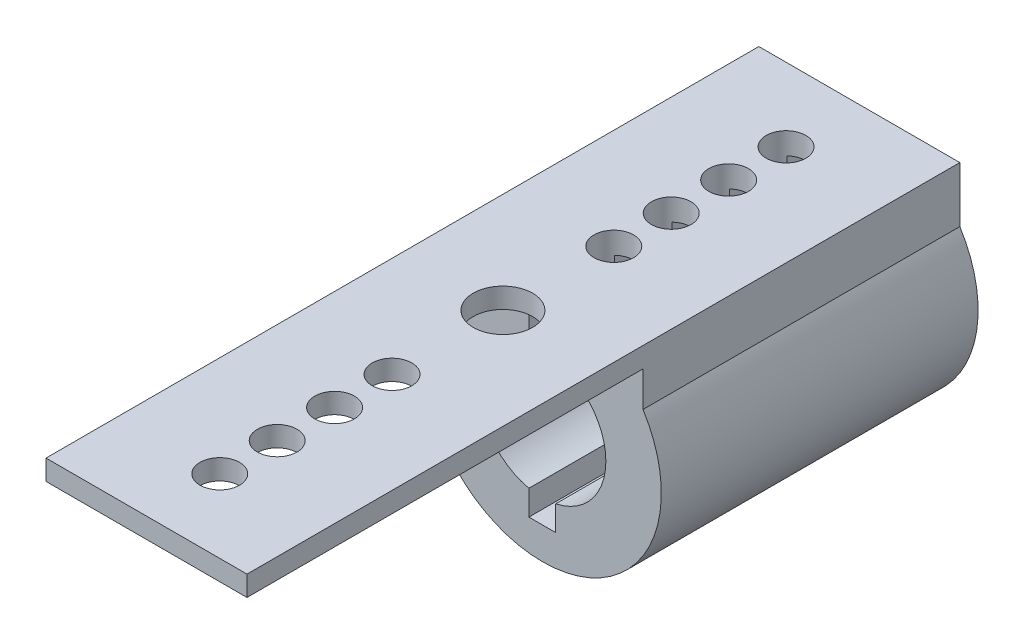
from build123d import *

# Parameters (mm, degrees)
SKETCH1_R               = 6
SKETCH1_R_2             = 3.2
BOSS_EXTRUDE1_DEPTH     = 16
SKETCH2_W               = 10.150862032
SKETCH2_H               = 2.8
BOSS_EXTRUDE2_DEPTH     = 16
CUT_EXTRUDE1_DEPTH      = 16
CUT_EXTRUDE1_DEPTH_BACK = 1
SKETCH3_W               = 1.354750416
SKETCH3_H               = 9.28691227
SKETCH4_W               = 10.150862032
SKETCH4_H               = 1.022764777
BOSS_EXTRUDE3_DEPTH     = 36
SKETCH5_R               = 1.5
CUT_EXTRUDE2_DEPTH      = 11
CUT_EXTRUDE3_DEPTH      = 11
CUT_EXTRUDE3_DEPTH_BACK = 0.1
SKETCH6_R               = 1


with BuildPart() as part:
    # Sketch1 → Boss-Extrude1 (new body)
    with BuildSketch(Plane.XY):
        Circle(SKETCH1_R)
        Circle(SKETCH1_R_2, mode=Mode.SUBTRACT)
    extrude(amount=BOSS_EXTRUDE1_DEPTH)

    # Sketch2 → Boss-Extrude2 (add)
    with BuildSketch(Plane.XY):
        with Locations((0, 4.6)):
            Rectangle(SKETCH2_W, SKETCH2_H)
    extrude(amount=BOSS_EXTRUDE2_DEPTH)

    # Sketch3 → Cut-Extrude1 (cut, two sides: drawn at the far end of the back side and taken through both)
    with BuildSketch(Plane.XY.offset(-CUT_EXTRUDE1_DEPTH_BACK)):
        with Locations((-0.009817032, 0.255242832)):
            Rectangle(SKETCH3_W, SKETCH3_H)
    extrude(amount=CUT_EXTRUDE1_DEPTH + CUT_EXTRUDE1_DEPTH_BACK, mode=Mode.SUBTRACT)

    # Sketch4 → Boss-Extrude3 (add)
    with BuildSketch(Plane.XY):
        with Locations((0, 5.488617612)):
            Rectangle(SKETCH4_W, SKETCH4_H)
    extrude(amount=BOSS_EXTRUDE3_DEPTH)

    # Sketch5 → Cut-Extrude2 (cut)
    with BuildSketch(Plane(origin=(0, 0, 0), x_dir=(1, 0, 0), z_dir=(0, 1, 0))):
        with Locations(Location((0, -18, 0), (0, 0, 90))):
            Circle(SKETCH5_R)
    extrude(amount=CUT_EXTRUDE2_DEPTH, mode=Mode.SUBTRACT)

    # Sketch6 → Cut-Extrude3 (cut, two sides: drawn at the far end of the back side and taken through both)
    with BuildSketch(Plane(origin=(0, 0, 0), x_dir=(1, 0, 0), z_dir=(0, 1, 0)).offset(-CUT_EXTRUDE3_DEPTH_BACK)):
        with Locations(Location((0, -12.4, 0), (0, 0, 90))):
            Circle(SKETCH6_R)
        with Locations(Location((0, -9.5, 0), (0, 0, 90))):
            Circle(SKETCH6_R)
        with Locations(Location((0, -6.6, 0), (0, 0, 90))):
            Circle(SKETCH6_R)
        with Locations(Location((0, -3.7, 0), (0, 0, 90))):
            Circle(SKETCH6_R)
        with Locations(Location((0, -23.6, 0), (0, 0, 90))):
            Circle(SKETCH6_R)
        with Locations(Location((0, -26.5, 0), (0, 0, 90))):
            Circle(SKETCH6_R)
        with Locations(Location((0, -29.4, 0), (0, 0, 90))):
            Circle(SKETCH6_R)
        with Locations(Location((0, -32.3, 0), (0, 0, 90))):
            Circle(SKETCH6_R)
    extrude(amount=CUT_EXTRUDE3_DEPTH + CUT_EXTRUDE3_DEPTH_BACK, mode=Mode.SUBTRACT)


solid = part.part
